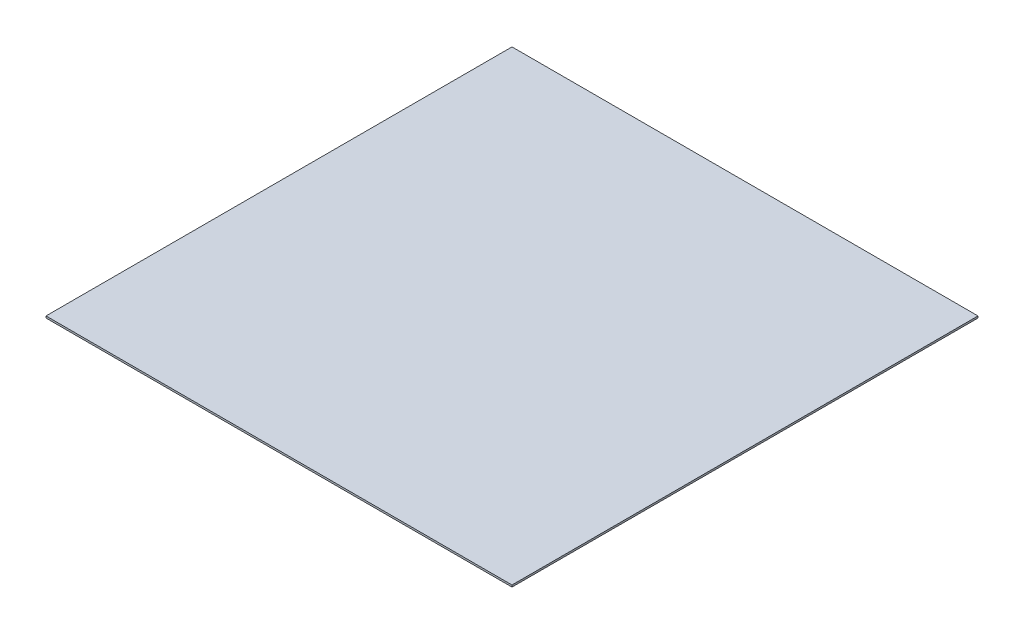
from build123d import *

# Parameters (mm, degrees)
SKETCH1_W           = 250
SKETCH1_H           = 250
BOSS_EXTRUDE1_DEPTH = 1


with BuildPart() as part:
    # Sketch1 → Boss-Extrude1 (new body)
    with BuildSketch(Plane(origin=(0, 0, 0), x_dir=(1, 0, 0), z_dir=(0, 1, 0))):
        Rectangle(SKETCH1_W, SKETCH1_H)
    extrude(amount=BOSS_EXTRUDE1_DEPTH)


solid = part.part
